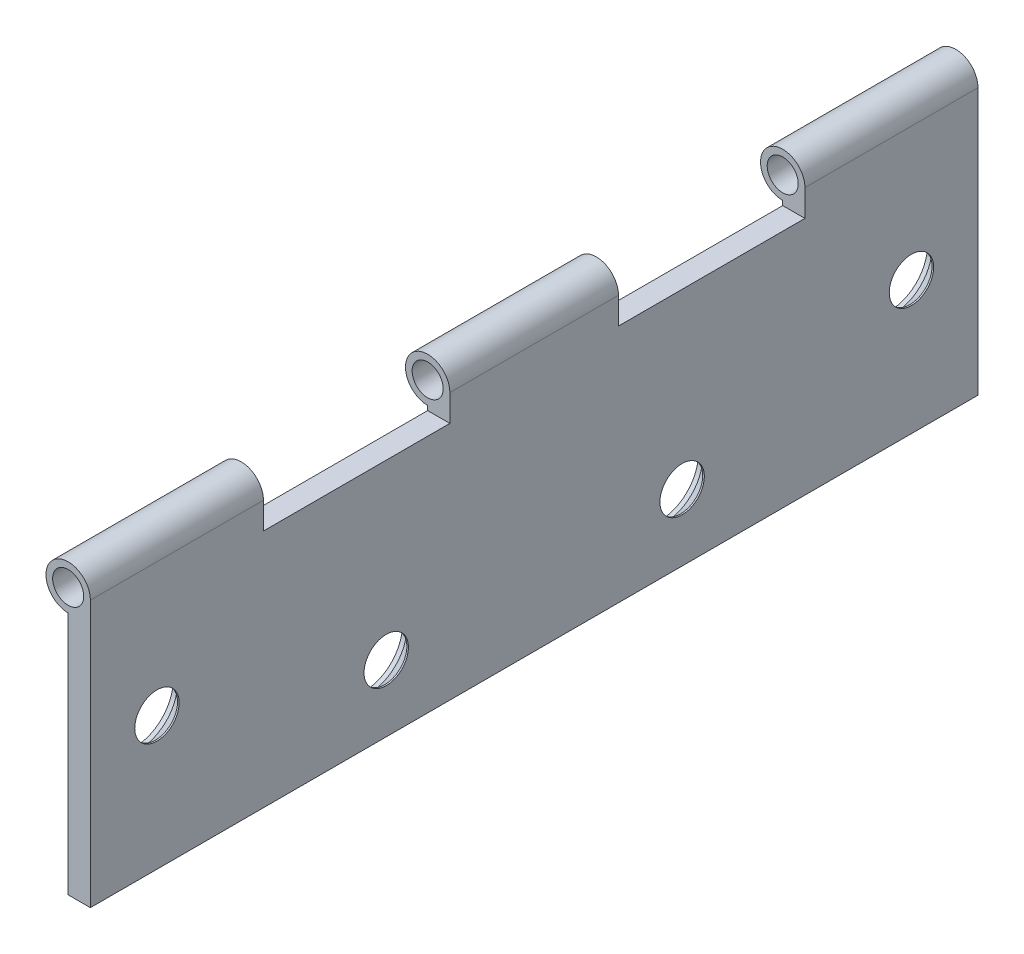
from build123d import *

# Parameters (mm, degrees)
SKETCH1_W                                      = 5
SKETCH1_H                                      = 60
EXTRUDE_THIN1_DEPTH                            = 100
SKETCH2_R                                      = 5
SKETCH3_R                                      = 3.5
CUT_EXTRUDE1_DEPTH                             = 211.35683968
CSK_FOR_M8_FLAT_HEAD_MACHINE_SCREW1_AT_2_COUNT = 2
CSK_FOR_M8_FLAT_HEAD_MACHINE_SCREW1_AT_2_PITCH = 53.800041305
F_2_CUTS_DEPTH                                 = 120.373363863
F_2_CUTS_DEPTH_BACK                            = 120.373363863
SKETCH8_W                                      = 42
SKETCH8_H                                      = 11


with BuildPart() as part:
    # Sketch1 → Extrude-Thin1 (new, symmetric)
    with BuildSketch(Plane.XY):
        with Locations((2.5, 30)):
            Rectangle(SKETCH1_W, SKETCH1_H)
    extrude(amount=EXTRUDE_THIN1_DEPTH, both=True)

    # Sweep1: sweep along a curve in space
    with BuildLine() as sweep1_path:
        Line((0, 60, 100), (0, 60, -100))
    # Sketch2 → Sweep1 (sweep)
    with BuildSketch(Plane(origin=(0, 0, -100), x_dir=(-1, 0, 0), z_dir=(0, 0, -1))):
        with Locations((0, 60)):
            Circle(SKETCH2_R)
    sweep(path=sweep1_path.line)

    # Sketch3 → Cut-Extrude1 (cut, through all)
    with BuildSketch(Plane(origin=(0, 0, -100), x_dir=(-1, 0, 0), z_dir=(0, 0, -1))):
        with Locations((0, 60)):
            Circle(SKETCH3_R)
    extrude(amount=-CUT_EXTRUDE1_DEPTH, mode=Mode.SUBTRACT)

    # Sketch4 → CSK for M8 Flat Head Machine Screw1 (revolve, cut)
    with BuildSketch(Plane(origin=(0, 30, -85), x_dir=(0, 0, 1), z_dir=(0, 1, 0))):
        Polygon((0, 0), (0, 5), (5, 5), (5, 4.65), (8.65, 1), (8.65, 0), align=None)
    csk_for_m8_flat_head_machine_screw1 = revolve(axis=Axis((-6.35, 30, -85), (1, 0, 0)), mode=Mode.SUBTRACT)

    # CSK for M8 Flat Head Machine Screw1 at 2: CSK for M8 Flat Head Machine Screw1 ×2
    with Locations(*[Vector(0, -0.2788101948639552, 0.9603462267536241) * (i * CSK_FOR_M8_FLAT_HEAD_MACHINE_SCREW1_AT_2_PITCH) for i in range(1, CSK_FOR_M8_FLAT_HEAD_MACHINE_SCREW1_AT_2_COUNT)]):
        add(csk_for_m8_flat_head_machine_screw1, mode=Mode.SUBTRACT)

    # Mirror1: CSK for M8 Flat Head Machine Screw1 across plane
    add(csk_for_m8_flat_head_machine_screw1.mirror(Plane.XY), mode=Mode.SUBTRACT)

    # Mirror1 copy 1 sketch → Mirror1 copy 1 (revolve, cut)
    with BuildSketch(Plane(origin=(0, 15, 33.333333333), x_dir=(0, 0, -1), z_dir=(0, 1, 0))):
        Polygon((0, 0), (0, -5), (5, -5), (5, -4.65), (8.65, -1), (8.65, 0), align=None)
    revolve(axis=Axis((-6.35, 15, 33.333333333), (-1, 0, 0)), mode=Mode.SUBTRACT)

    # Sketch8 → 2 cuts (cut, two sides: drawn at the far end of the back side and taken through both)
    with BuildSketch(Plane.ZY.offset(-F_2_CUTS_DEPTH_BACK)):
        with Locations((-40, 59.5)):
            Rectangle(SKETCH8_W, SKETCH8_H)
        with Locations((40, 59.5)):
            Rectangle(SKETCH8_W, SKETCH8_H)
    extrude(amount=F_2_CUTS_DEPTH + F_2_CUTS_DEPTH_BACK, mode=Mode.SUBTRACT)


solid = part.part
